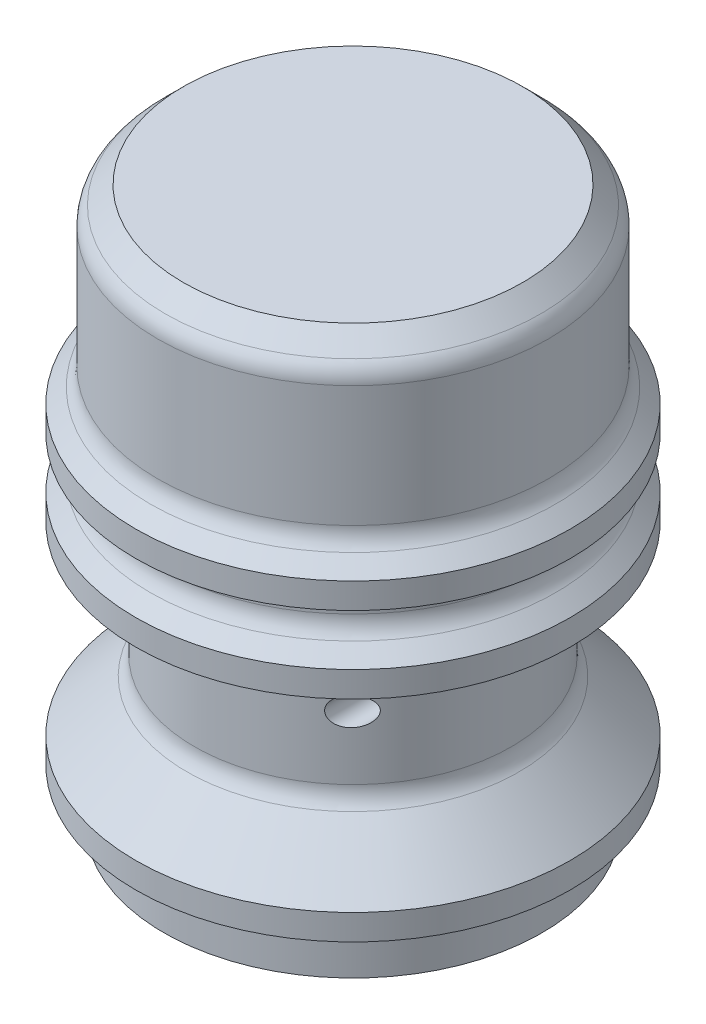
from build123d import *

# Parameters (mm, degrees)
CORTE_EXTRUS_O1_REACH      = 30.96
CORTE_EXTRUS_O1_END_RADIUS = 4.889
ESBO_O9_R                  = 0.546
PADR_OCIRCULAR2_COUNT      = 4
CHANFRO1_SIZE              = 1
FILETE3_R                  = 1
FILETE_TOPO_R              = 0.35
FILETE_BASE_R              = 2
FILETE4_R                  = 1
FILETE5_R                  = 0.5
ESBO_O13_R                 = 4.455
CORTE_EXTRUS_O3_DEPTH      = 8.232


with BuildPart() as part:
    # Esboço4 → Revolução1 (revolve)
    with BuildSketch(Plane.XY, mode=Mode.PRIVATE) as revolu_o1_sk:
        Polygon((3.105, 1), (3.105, 10.329), (5.46, 12.684), (5.46, 19.658), (0, 19.658), (0, 21.658), (7.641447786, 21.658), (7.641447786, 10.732), (6.204569846, 10.732), (6.204569846, 4), (7.4, 4), (7.4, 0), (5.798, 0), (5.798, 2.899), (4.889, 4.473434184), (4.889, 4.889), (4.889, 9.232), (4.105, 9.232), (4.105, 1), align=None)
    revolve(revolu_o1_sk.sketch.rotate(Axis((0, 0, 0), (0, 1, 0)), 90), axis=Axis((0, 0, 0), (0, 1, 0)))

    # Corte-extrusão1: up to this cylinder (the profile starts outside it)
    corte_extrus_o1_end = Plane(origin=(0, 8.186, 0), z_dir=(0, -1, 0)) * Cylinder(CORTE_EXTRUS_O1_END_RADIUS, 72.698, mode=Mode.PRIVATE)
    # Esboço9 → Corte-extrusão1 (cut, up to the surface)
    with BuildSketch(Plane.XY.offset(-10), mode=Mode.PRIVATE) as corte_extrus_o1_sk1:
        with Locations(Location((-4.343, 8.186, 0), (0, 0, 180))):
            Circle(ESBO_O9_R)
    corte_extrus_o1_tool1 = extrude(corte_extrus_o1_sk1.sketch, amount=CORTE_EXTRUS_O1_REACH, mode=Mode.PRIVATE) - corte_extrus_o1_end
    corte_extrus_o1 = corte_extrus_o1_tool1.solids().sort_by_distance((-4.343, 8.186, -10))[0]
    add(corte_extrus_o1, mode=Mode.SUBTRACT)

    # PadrãoCircular2: Corte-extrusão1 ×4 about axis
    padr_ocircular2_axis = Axis((0, 0, 0), (0, 1, 0))
    for i in range(1, PADR_OCIRCULAR2_COUNT):
        add(corte_extrus_o1.rotate(padr_ocircular2_axis, i * 360 / PADR_OCIRCULAR2_COUNT), mode=Mode.SUBTRACT)

    # Chanfro1
    chanfro1_edges = [part.edges().sort_by_distance(p)[0] for p in [
        (0, 21.658, 7.641447786),
    ]]
    chamfer(chanfro1_edges, length=CHANFRO1_SIZE)

    # Filete3
    filete3_edges = [part.edges().sort_by_distance(p)[0] for p in [
        (0, 20.658, 7.641447786),
    ]]
    fillet(filete3_edges, radius=FILETE3_R)

    # Filete_topo
    filete_topo_edges = [part.edges().sort_by_distance(p)[0] for p in [
        (0, 9.232, 4.105),
        (0, 9.232, 4.889),
        (0, 19.658, 5.46),
    ]]
    fillet(filete_topo_edges, radius=FILETE_TOPO_R)

    # Filete_base
    filete_base_edges = [part.edges().sort_by_distance(p)[0] for p in [
        (0, 4.473434184, 4.889),
        (0, 2.899, 5.798),
        (0, 12.684, 5.46),
        (0, 10.329, 3.105),
    ]]
    fillet(filete_base_edges, radius=FILETE_BASE_R)

    # Esboço11 → Revolução2 (revolve)
    with BuildSketch(Plane.XY, mode=Mode.PRIVATE) as revolu_o2_sk:
        Polygon((6.204569846, 10.232), (8.5, 10.232), (8.5, 11.232), (7.641447786, 12.090552214), (7.641447786, 13.232), (8.5, 13.232), (8.5, 14.232), (7.641447786, 15.090552214), (7.141447786, 15.090552214), (7.141447786, 11.232), (5.704569846, 11.232), (5.704569846, 10.232), align=None)
        Polygon((7.4, 2), (8.5, 2), (8.5, 3), (6.204569846, 5.295430154), (5.704569846, 5.295430154), (5.704569846, 4), (6.9, 2), align=None)
    revolve(revolu_o2_sk.sketch.rotate(Axis((0, 0, 0), (0, 1, 0)), 90), axis=Axis((0, 0, 0), (0, 1, 0)))

    # Filete4
    filete4_edges = [part.edges().sort_by_distance(p)[0] for p in [
        (0, 5.295430154, 6.204569846),
        (0, 15.090552214, 7.641447786),
        (0, 12.090552214, 7.641447786),
        (0, 10.232, 6.204569846),
    ]]
    fillet(filete4_edges, radius=FILETE4_R)

    # Filete5
    filete5_edges = [part.edges().sort_by_distance(p)[0] for p in [
        (0, 2, 7.4),
        (0, 13.232, 7.641447786),
    ]]
    fillet(filete5_edges, radius=FILETE5_R)

    # Esboço12 → Revolução3 (revolve)
    with BuildSketch(Plane.XY, mode=Mode.PRIVATE) as revolu_o3_sk:
        Polygon((-3.755907377, 1), (-3.755907377, 10.085784813), (-6.693701371, 13.543615987), (-6.693701371, 20.463139806), (0, 20.463139806), (0, 1), align=None)
    revolve(revolu_o3_sk.sketch.rotate(Axis((0, 0, 0), (0, -1, 0)), 90), axis=Axis((0, 0, 0), (0, -1, 0)))

    # Esboço13 → Corte-extrusão3 (cut)
    with BuildSketch(Plane.XZ.offset(-1)):
        Circle(ESBO_O13_R)
    extrude(amount=-CORTE_EXTRUS_O3_DEPTH, mode=Mode.SUBTRACT)


solid = part.part
